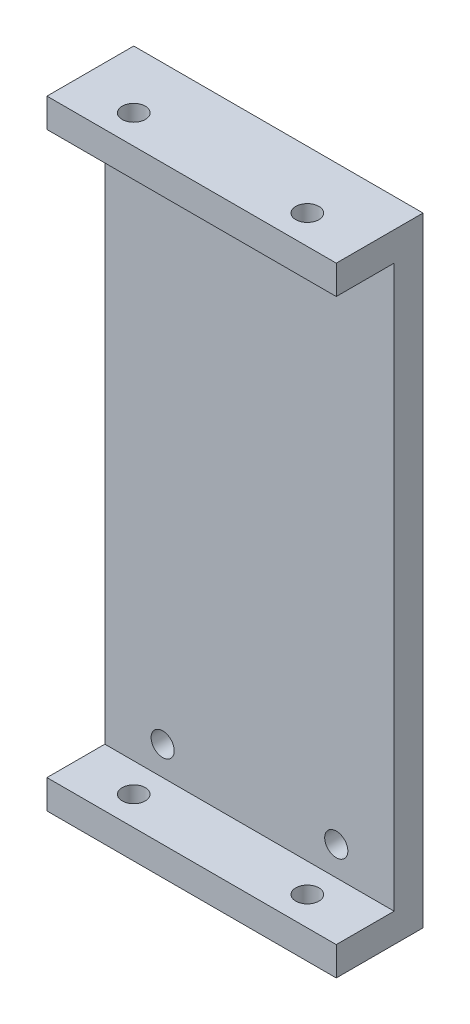
from build123d import *

# Parameters (mm, degrees)
SKETCH1_W                       = 50
SKETCH1_H                       = 15
BOSS_EXTRUDE1_DEPTH             = 5
SKETCH2_W                       = 50
SKETCH2_H                       = 5
BOSS_EXTRUDE2_DEPTH             = 97
SKETCH3_W                       = 50
SKETCH3_H                       = 15
BOSS_EXTRUDE3_DEPTH             = 5
F_4_0MM_DOWEL_HOLE1_D           = 4
F_4_0MM_DOWEL_HOLE1_ON_FACE_2_D = 4
F_4_0MM_DOWEL_HOLE1_ON_FACE_3_D = 4


with BuildPart() as part:
    # Sketch1 → Boss-Extrude1 (new body)
    with BuildSketch(Plane(origin=(0, 0, 0), x_dir=(1, 0, 0), z_dir=(0, 1, 0))):
        Rectangle(SKETCH1_W, SKETCH1_H)
    extrude(amount=-BOSS_EXTRUDE1_DEPTH)

    # Sketch2 → Boss-Extrude2 (add)
    with BuildSketch(Plane(origin=(0, 0, 0), x_dir=(1, 0, 0), z_dir=(0, 1, 0))):
        with Locations((0, 5)):
            Rectangle(SKETCH2_W, SKETCH2_H)
    extrude(amount=BOSS_EXTRUDE2_DEPTH)

    # Sketch3 → Boss-Extrude3 (add)
    with BuildSketch(Plane(origin=(0, 97, 0), x_dir=(1, 0, 0), z_dir=(0, 1, 0))):
        Rectangle(SKETCH3_W, SKETCH3_H)
    extrude(amount=BOSS_EXTRUDE3_DEPTH)

    # Ø4.0mm Dowel Hole1 (through all)
    with Locations(Plane(origin=(-15, 0, 2.5), x_dir=(0, 0, 1), z_dir=(0, 1, 0))):
        with Locations((0, 0), (0, 30)):
            Hole(F_4_0MM_DOWEL_HOLE1_D / 2)

    # Ø4.0mm Dowel Hole1 on face 2 (through all)
    with Locations(Plane(origin=(-15, 5, -2.5), x_dir=(1, 0, 0), z_dir=(0, 0, 1))):
        with Locations((0, 0), (30, 0), (0, 87), (30, 87)):
            Hole(F_4_0MM_DOWEL_HOLE1_ON_FACE_2_D / 2)

    # Ø4.0mm Dowel Hole1 on face 3 (through all)
    with Locations(Plane(origin=(15, 97, 2.5), x_dir=(0, 0, -1), z_dir=(0, -1, 0))):
        with Locations((0, 0), (0, -30)):
            Hole(F_4_0MM_DOWEL_HOLE1_ON_FACE_3_D / 2)


solid = part.part
